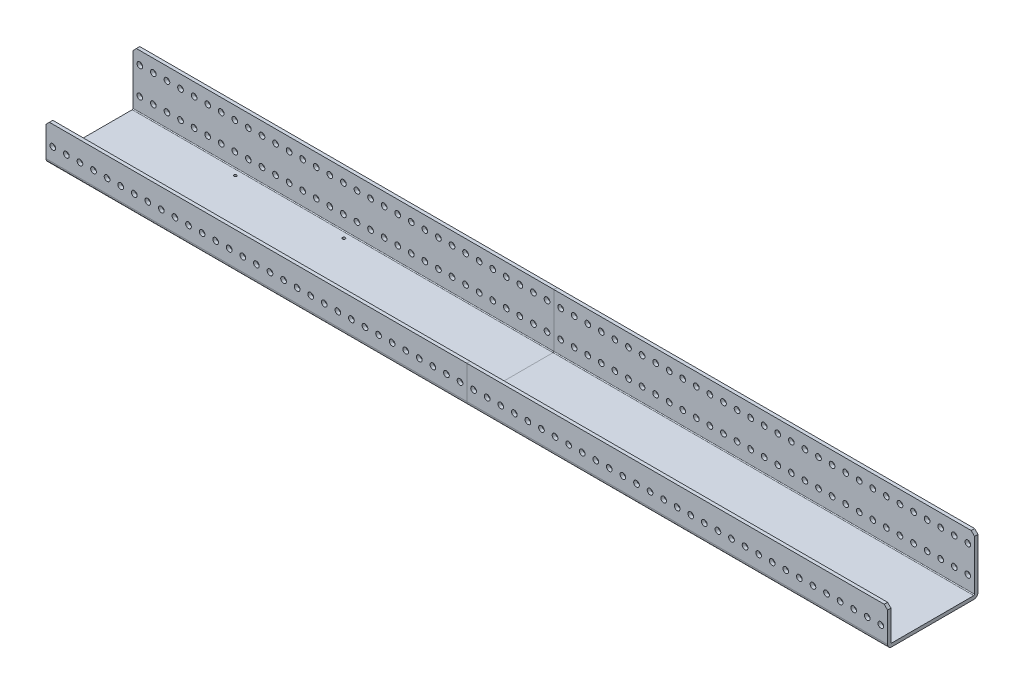
from build123d import *

# Parameters (mm, degrees)
SKETCH1_W                  = 787.4
SKETCH1_H                  = 84.582
BOSS_EXTRUDE1_DEPTH        = 53.975
SKETCH2_W                  = 81.407
SKETCH2_H                  = 50.8
CUT_EXTRUDE1_DEPTH         = 794.435038471
SKETCH3_W                  = 787.4
SKETCH3_H                  = 3.175
BOSS_EXTRUDE2_DEPTH        = 31.75
F_2_CLEARANCE_HOLE1_D      = 2.54
F_10_CLEARANCE_HOLE1_D     = 5.334
F_10_CLEARANCE_HOLE1_DEPTH = 3.175
F_10_CLEARANCE_HOLE2_D     = 5.334
F_10_CLEARANCE_HOLE2_DEPTH = 84.582
CHAMFER1_SIZE              = 3.175
FILLET1_R                  = 0.762
FILLET2_R                  = 3.937
SPLIT2_SURFACE_1_BACK      = 794.767
SPLIT2_SURFACE_1_DEPTH     = 1589.534
SPLIT2_SURFACE_2_BACK      = 794.767
SPLIT2_SURFACE_2_DEPTH     = 1589.534


with BuildPart() as part:
    # Sketch1 → Boss-Extrude1 (new body)
    with BuildSketch(Plane(origin=(0, 53.975, 0), x_dir=(1, 0, 0), z_dir=(0, 1, 0))):
        with Locations((393.7, 39.116)):
            Rectangle(SKETCH1_W, SKETCH1_H)
    extrude(amount=-BOSS_EXTRUDE1_DEPTH)

    # Sketch2 → Cut-Extrude1 (cut, through all)
    with BuildSketch(Plane(origin=(787.4, 0, 0), x_dir=(0, 0, -1), z_dir=(1, 0, 0))):
        with Locations((37.5285, 28.575)):
            Rectangle(SKETCH2_W, SKETCH2_H)
    extrude(amount=-CUT_EXTRUDE1_DEPTH, mode=Mode.SUBTRACT)

    # Sketch3 → Boss-Extrude2 (add)
    with BuildSketch(Plane(origin=(0, 3.175, 0), x_dir=(-1, 0, 0), z_dir=(0, 1, 0))):
        with Locations((-393.7, 1.5875)):
            Rectangle(SKETCH3_W, SKETCH3_H)
    extrude(amount=BOSS_EXTRUDE2_DEPTH)

    # #2 Clearance Hole1 (through all)
    with Locations(Plane(origin=(0, 3.175, 0), x_dir=(1, 0, 0), z_dir=(0, 1, 0))):
        with Locations((101.6, 5.842), (203.2, 5.842), (203.2, 72.39), (101.6, 72.39)):
            Hole(F_2_CLEARANCE_HOLE1_D / 2)

    # #10 Clearance Hole1
    with Locations(Plane.XY.offset(3.175)):
        with Locations((768.35, 16.637), (781.05, 16.637), (755.65, 16.637), (742.95, 16.637), (730.25, 16.637), (717.55, 16.637), (704.85, 16.637), (692.15, 16.637), (679.45, 16.637), (666.75, 16.637), (654.05, 16.637), (641.35, 16.637), (628.65, 16.637), (615.95, 16.637), (603.25, 16.637), (590.55, 16.637), (577.85, 16.637), (565.15, 16.637), (552.45, 16.637), (539.75, 16.637), (527.05, 16.637), (514.35, 16.637), (501.65, 16.637), (488.95, 16.637), (476.25, 16.637), (463.55, 16.637), (450.85, 16.637), (438.15, 16.637), (425.45, 16.637), (412.75, 16.637), (400.05, 16.637), (387.35, 16.637), (374.65, 16.637), (361.95, 16.637), (349.25, 16.637), (336.55, 16.637), (323.85, 16.637), (311.15, 16.637), (298.45, 16.637), (285.75, 16.637), (273.05, 16.637), (260.35, 16.637), (247.65, 16.637), (234.95, 16.637), (222.25, 16.637), (209.55, 16.637), (196.85, 16.637), (184.15, 16.637), (171.45, 16.637), (158.75, 16.637), (146.05, 16.637), (133.35, 16.637), (120.65, 16.637), (107.95, 16.637), (95.25, 16.637), (82.55, 16.637), (69.85, 16.637), (57.15, 16.637), (44.45, 16.637), (31.75, 16.637), (19.05, 16.637), (6.35, 16.637)):
            Hole(F_10_CLEARANCE_HOLE1_D / 2, depth=F_10_CLEARANCE_HOLE1_DEPTH)

    # #10 Clearance Hole2
    with Locations(Plane(origin=(0, 0, -81.407), x_dir=(-1, 0, 0), z_dir=(0, 0, -1))):
        with Locations((-768.35, 42.037), (-781.05, 42.037), (-768.35, 16.637), (-781.05, 16.637), (-755.65, 16.637), (-742.95, 16.637), (-730.25, 16.637), (-717.55, 16.637), (-704.85, 16.637), (-692.15, 16.637), (-679.45, 16.637), (-666.75, 16.637), (-654.05, 16.637), (-641.35, 16.637), (-628.65, 16.637), (-615.95, 16.637), (-603.25, 16.637), (-590.55, 16.637), (-577.85, 16.637), (-565.15, 16.637), (-552.45, 16.637), (-539.75, 16.637), (-527.05, 16.637), (-514.35, 16.637), (-501.65, 16.637), (-488.95, 16.637), (-476.25, 16.637), (-463.55, 16.637), (-450.85, 16.637), (-438.15, 16.637), (-425.45, 16.637), (-412.75, 16.637), (-400.05, 16.637), (-387.35, 16.637), (-374.65, 16.637), (-361.95, 16.637), (-349.25, 16.637), (-336.55, 16.637), (-323.85, 16.637), (-311.15, 16.637), (-298.45, 16.637), (-285.75, 16.637), (-273.05, 16.637), (-260.35, 16.637), (-247.65, 16.637), (-234.95, 16.637), (-222.25, 16.637), (-209.55, 16.637), (-196.85, 16.637), (-184.15, 16.637), (-171.45, 16.637), (-158.75, 16.637), (-146.05, 16.637), (-133.35, 16.637), (-120.65, 16.637), (-107.95, 16.637), (-95.25, 16.637), (-82.55, 16.637), (-69.85, 16.637), (-57.15, 16.637), (-44.45, 16.637), (-31.75, 16.637), (-19.05, 16.637), (-6.35, 16.637), (-755.65, 42.037), (-742.95, 42.037), (-730.25, 42.037), (-717.55, 42.037), (-704.85, 42.037), (-692.15, 42.037), (-679.45, 42.037), (-666.75, 42.037), (-654.05, 42.037), (-641.35, 42.037), (-628.65, 42.037), (-615.95, 42.037), (-603.25, 42.037), (-590.55, 42.037), (-577.85, 42.037), (-565.15, 42.037), (-552.45, 42.037), (-539.75, 42.037), (-527.05, 42.037), (-514.35, 42.037), (-501.65, 42.037), (-488.95, 42.037), (-476.25, 42.037), (-463.55, 42.037), (-450.85, 42.037), (-438.15, 42.037), (-425.45, 42.037), (-412.75, 42.037), (-400.05, 42.037), (-387.35, 42.037), (-374.65, 42.037), (-361.95, 42.037), (-349.25, 42.037), (-336.55, 42.037), (-323.85, 42.037), (-311.15, 42.037), (-298.45, 42.037), (-285.75, 42.037), (-273.05, 42.037), (-260.35, 42.037), (-247.65, 42.037), (-234.95, 42.037), (-222.25, 42.037), (-209.55, 42.037), (-196.85, 42.037), (-184.15, 42.037), (-171.45, 42.037), (-158.75, 42.037), (-146.05, 42.037), (-133.35, 42.037), (-120.65, 42.037), (-107.95, 42.037), (-95.25, 42.037), (-82.55, 42.037), (-69.85, 42.037), (-57.15, 42.037), (-44.45, 42.037), (-31.75, 42.037), (-19.05, 42.037), (-6.35, 42.037)):
            Hole(F_10_CLEARANCE_HOLE2_D / 2, depth=F_10_CLEARANCE_HOLE2_DEPTH)

    # Chamfer1
    chamfer1_edges = [part.edges().sort_by_distance(p)[0] for p in [
        (787.4, 53.975, -79.8195),
        (0, 34.925, 1.5875),
        (787.4, 34.925, 1.5875),
        (0, 53.975, -79.8195),
    ]]
    chamfer(chamfer1_edges, length=CHAMFER1_SIZE)

    # Fillet1
    fillet1_edges = [part.edges().sort_by_distance(p)[0] for p in [
        (393.7, 3.175, -78.232),
        (393.7, 3.175, 0),
    ]]
    fillet(fillet1_edges, radius=FILLET1_R)

    # Fillet2
    fillet2_edges = [part.edges().sort_by_distance(p)[0] for p in [
        (393.7, 0, 3.175),
        (393.7, 0, -81.407),
    ]]
    fillet(fillet2_edges, radius=FILLET2_R)


with BuildPart() as body_2:
    # Split2: the piece behind the surface
    add(part.part)
    # Split2 surface: a surface, the sketch's curves swept straight by 1589.534 mm
    with BuildLine(Plane(origin=(0, 53.975, 0), x_dir=(1, 0, 0), z_dir=(0, 1, 0)).offset(-SPLIT2_SURFACE_1_BACK), mode=Mode.PRIVATE) as split2_surface_1_path:
        Line((393.7, 81.407), (393.7, -54.365121347))
    split2_surface_1 = Shell.extrude(split2_surface_1_path.wire(), (0 * SPLIT2_SURFACE_1_DEPTH, 1 * SPLIT2_SURFACE_1_DEPTH, 0 * SPLIT2_SURFACE_1_DEPTH))
    split(bisect_by=split2_surface_1, keep=Keep.BOTTOM)


with BuildPart() as part_1:
    add(part.part)

    # Split2: split by a surface, the side it looks to stays
    # Split2 surface: a surface, the sketch's curves swept straight by 1589.534 mm
    with BuildLine(Plane(origin=(0, 53.975, 0), x_dir=(1, 0, 0), z_dir=(0, 1, 0)).offset(-SPLIT2_SURFACE_2_BACK), mode=Mode.PRIVATE) as split2_surface_2_path:
        Line((393.7, 81.407), (393.7, -54.365121347))
    split2_surface_2 = Shell.extrude(split2_surface_2_path.wire(), (0 * SPLIT2_SURFACE_2_DEPTH, 1 * SPLIT2_SURFACE_2_DEPTH, 0 * SPLIT2_SURFACE_2_DEPTH))
    split(bisect_by=split2_surface_2, keep=Keep.TOP)


solid = Compound([body_2.part, part_1.part])
